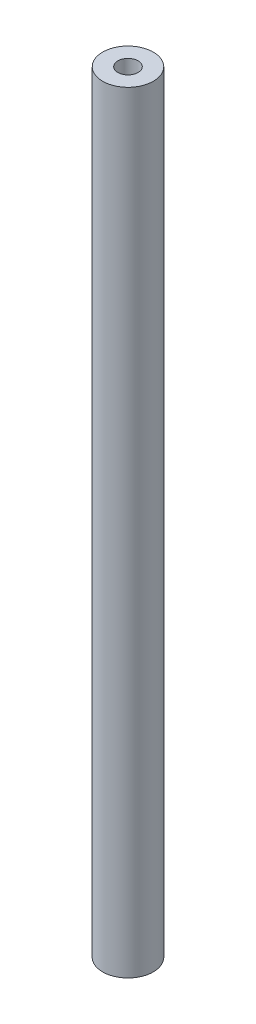
from build123d import *

# Parameters (mm, degrees)
SKETCH1_R           = 15
SKETCH1_R_2         = 6
BOSS_EXTRUDE1_DEPTH = 228.6


with BuildPart() as part:
    # Sketch1 → Boss-Extrude1 (new, symmetric)
    with BuildSketch(Plane(origin=(0, 0, 0), x_dir=(1, 0, 0), z_dir=(0, 1, 0))):
        with Locations(Location((0, 0, 0), (0, 0, 270))):
            Circle(SKETCH1_R)
        with Locations(Location((0, 0, 0), (0, 0, 270))):
            Circle(SKETCH1_R_2, mode=Mode.SUBTRACT)
    extrude(amount=BOSS_EXTRUDE1_DEPTH, both=True)


solid = part.part
